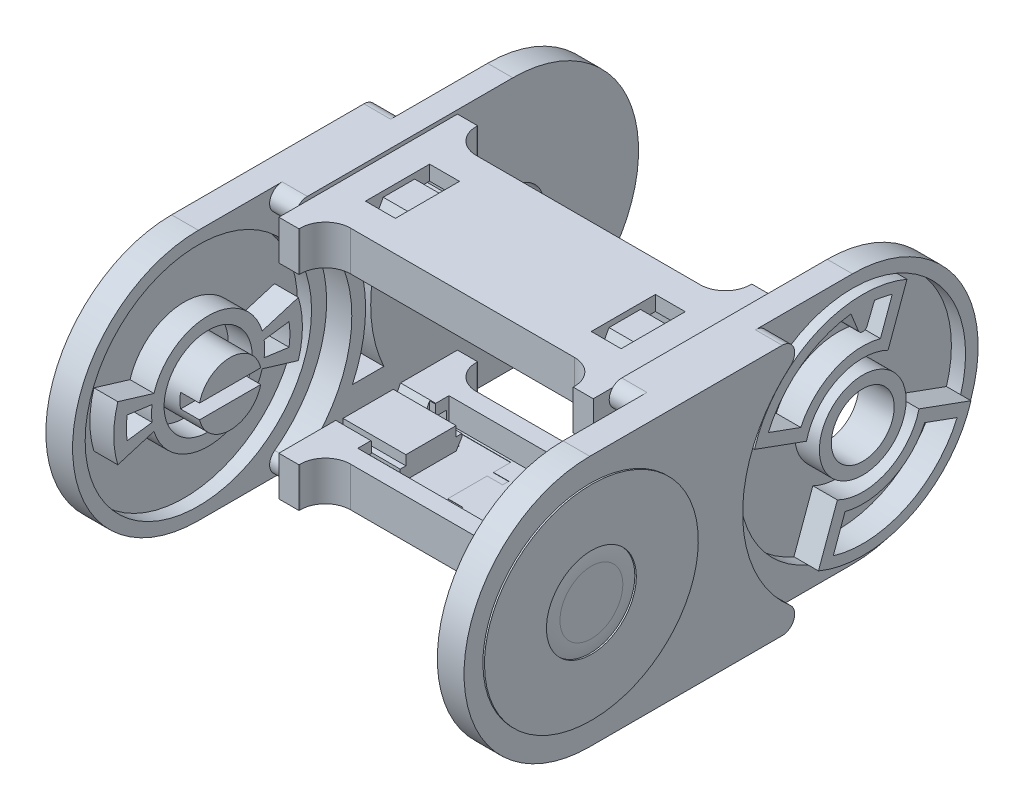
from build123d import *

# Parameters (mm, degrees)
SKETCH1_R            = 5
BOSS_EXTRUDE1_DEPTH  = 2
SKETCH2_RX           = 17
SKETCH2_RY           = 16.25
SKETCH2_R            = 7.15
BOSS_EXTRUDE2_DEPTH  = 0.25
BOSS_EXTRUDE3_START  = 2.25
SKETCH3_R            = 18
BOSS_EXTRUDE3_DEPTH  = 2.25
SKETCH5_R            = 7
BOSS_EXTRUDE4_DEPTH  = 3.8
SKETCH6_R            = 5
BOSS_EXTRUDE5_DEPTH  = 4
SKETCH7_R            = 18
CUT_EXTRUDE1_DEPTH   = 2.25
BOSS_EXTRUDE6_START  = 3.9
SKETCH8_R            = 6.9
SKETCH8_R_2          = 5
BOSS_EXTRUDE6_DEPTH  = 3.9
BOSS_EXTRUDE7_REACH  = 71.195
CUT_EXTRUDE2_DEPTH   = 6.3
BOSS_EXTRUDE8_DEPTH  = 10
BOSS_EXTRUDE9_DEPTH  = 4.3
SKETCH17_W           = 4.75
SKETCH17_H           = 10.2
BOSS_EXTRUDE10_DEPTH = 6.3
SKETCH18_W           = 13.78
SKETCH18_H           = 2.15
CUT_EXTRUDE3_DEPTH   = 15.8
CUT_EXTRUDE4_DEPTH   = 11.25
CUT_EXTRUDE5_START   = -3.95
SKETCH20_W           = 7
SKETCH20_H           = 1
CUT_EXTRUDE5_DEPTH   = 3.95
SKETCH21_W           = 38.8
SKETCH21_H           = 14.5
CUT_EXTRUDE6_DEPTH   = 3.9
SKETCH24_W           = 10
SKETCH24_H           = 2.3
CUT_EXTRUDE7_DEPTH   = 3


with BuildPart() as part:
    # Sketch1 → Boss-Extrude1 (new body)
    with BuildSketch(Plane(origin=(31.25, 0, 0), x_dir=(0, 0, -1), z_dir=(1, 0, 0))):
        with BuildLine():
            Line((0, 20), (30.582801811, 20))
            ThreePointArc((30.582801811, 20), (32.458698221, 18.693550761), (31.883831194, 16.481012658))
            ThreePointArc((31.883831194, 16.481012658), (24.3, 0), (31.883831194, -16.481012658))
            ThreePointArc((31.883831194, -16.481012658), (32.458698221, -18.693550761), (30.582801811, -20))
            Line((30.582801811, -20), (0, -20))
            ThreePointArc((0, -20), (-20, 0), (0, 20))
        make_face()
        Circle(SKETCH1_R, mode=Mode.SUBTRACT)
    extrude(amount=BOSS_EXTRUDE1_DEPTH)

    # Sketch2 → Boss-Extrude2 (add)
    with BuildSketch(Plane(origin=(33.25, 0, 0), x_dir=(0, 0, -1), z_dir=(1, 0, 0))):
        with Locations(Location((0, 0), (0, 0, 180))):
            Ellipse(SKETCH2_RX, SKETCH2_RY)
        Circle(SKETCH2_R, mode=Mode.SUBTRACT)
    extrude(amount=BOSS_EXTRUDE2_DEPTH)

    # Sketch3 → Boss-Extrude3 (add)
    with BuildSketch(Plane.ZY.offset(-31.25).offset(BOSS_EXTRUDE3_START)):
        with BuildLine():
            Line((-30.582801811, -20), (0, -20))
            ThreePointArc((0, -20), (20, 0), (0, 20))
            Line((0, 20), (-30.582801811, 20))
            ThreePointArc((-30.582801811, 20), (-32.458698221, 18.693550761), (-31.883831194, 16.481012658))
            ThreePointArc((-31.883831194, 16.481012658), (-24.3, 0), (-31.883831194, -16.481012658))
            ThreePointArc((-31.883831194, -16.481012658), (-32.458698221, -18.693550761), (-30.582801811, -20))
        make_face()
        Circle(SKETCH3_R, mode=Mode.SUBTRACT)
    extrude(amount=-BOSS_EXTRUDE3_DEPTH)

    # Sketch5 → Boss-Extrude4 (add)
    with BuildSketch(Plane.ZY.offset(-31.25)):
        with BuildLine():
            Line((-8.613239809, 2.61), (-14.355399681, 4.35))
            ThreePointArc((-14.355399681, 4.35), (-15, 0), (-14.355399681, -4.35))
            Line((-14.355399681, -4.35), (-8.613239809, -2.61))
            ThreePointArc((-8.613239809, -2.61), (0, -9), (8.613239809, -2.61))
            Line((8.613239809, -2.61), (14.355399681, -4.35))
            ThreePointArc((14.355399681, -4.35), (15, 0), (14.355399681, 4.35))
            Line((14.355399681, 4.35), (8.613239809, 2.61))
            ThreePointArc((8.613239809, 2.61), (0, 9), (-8.613239809, 2.61))
        make_face()
        with Locations(Location((0, 0, 0), (0, 0, 180))):
            Circle(SKETCH5_R, mode=Mode.SUBTRACT)
        with BuildLine():
            Line((-12.877930704, 1.777329677), (-8.915490487, 1.230459007))
            ThreePointArc((-8.915490487, 1.230459007), (-9, 0), (-8.915490487, -1.230459007))
            Line((-8.915490487, -1.230459007), (-12.877930704, -1.777329677))
            ThreePointArc((-12.877930704, -1.777329677), (-13, 0), (-12.877930704, 1.777329677))
        make_face(mode=Mode.SUBTRACT)
        with BuildLine():
            Line((12.877930704, -1.777329677), (8.915490487, -1.230459007))
            ThreePointArc((8.915490487, -1.230459007), (9, 0), (8.915490487, 1.230459007))
            Line((8.915490487, 1.230459007), (12.877930704, 1.777329677))
            ThreePointArc((12.877930704, 1.777329677), (13, 0), (12.877930704, -1.777329677))
        make_face(mode=Mode.SUBTRACT)
    extrude(amount=BOSS_EXTRUDE4_DEPTH)

    # Sketch6 → Boss-Extrude5 (add)
    with BuildSketch(Plane(origin=(29, 0, 0), x_dir=(0, 0, -1), z_dir=(1, 0, 0))):
        with BuildLine():
            Line((13.33266665, 20), (46, 20))
            ThreePointArc((46, 20), (66, 0), (46, -20))
            Line((46, -20), (13.33266665, -20))
            ThreePointArc((13.33266665, -20), (11.433418679, -18.626783171), (12.142249985, -16.392857143))
            ThreePointArc((12.142249985, -16.392857143), (20.4, 0), (12.142249985, 16.392857143))
            ThreePointArc((12.142249985, 16.392857143), (11.433418679, 18.626783171), (13.33266665, 20))
        make_face()
        with Locations((46, 0)):
            Circle(SKETCH6_R, mode=Mode.SUBTRACT)
    extrude(amount=-BOSS_EXTRUDE5_DEPTH)

    # Sketch7 → Cut-Extrude1 (cut)
    with BuildSketch(Plane(origin=(29, 0, 0), x_dir=(0, 0, -1), z_dir=(1, 0, 0))):
        with Locations((46, 0)):
            Circle(SKETCH7_R)
    extrude(amount=-CUT_EXTRUDE1_DEPTH, mode=Mode.SUBTRACT)

    # Sketch8 → Boss-Extrude6 (add)
    # profile 1 of 3: a face of its own
    with BuildSketch(Plane(origin=(26.75, 0, 0), x_dir=(0, 0, -1), z_dir=(1, 0, 0)).offset(BOSS_EXTRUDE6_START)):
        with Locations((46, 0)):
            Circle(SKETCH8_R)
        with Locations((46, 0)):
            Circle(SKETCH8_R_2, mode=Mode.SUBTRACT)
    # profile 2 of 3: a face of its own
    with BuildSketch(Plane(origin=(26.75, 0, 0), x_dir=(0, 0, -1), z_dir=(1, 0, 0)).offset(BOSS_EXTRUDE6_START)):
        with BuildLine():
            Line((53.040490335, 16.565974038), (50.031068965, 8.297656778))
            ThreePointArc((50.031068965, 8.297656778), (42.101346535, 8.360689335), (37.05250495, 2.245652986))
            Line((37.05250495, 2.245652986), (28.784187689, 5.255074356))
            ThreePointArc((28.784187689, 5.255074356), (38.392871289, 16.313540167), (53.040490335, 16.565974038))
        make_face()
        with BuildLine():
            Line((50.689873826, 15.662936618), (48.81254202, 10.505009871))
            ThreePointArc((48.81254202, 10.505009871), (41.404026404, 9.856097184), (36.144828401, 4.597957999))
            Line((36.144828401, 4.597957999), (30.986901654, 6.475289806))
            ThreePointArc((30.986901654, 6.475289806), (39.090191421, 14.818132318), (50.689873826, 15.662936618))
        make_face(mode=Mode.SUBTRACT)
    # profile 3 of 3: a face of its own
    with BuildSketch(Plane(origin=(26.75, 0, 0), x_dir=(0, 0, -1), z_dir=(1, 0, 0)).offset(BOSS_EXTRUDE6_START)):
        with BuildLine():
            Line((41.968931035, -8.297656778), (38.959509665, -16.565974038))
            ThreePointArc((38.959509665, -16.565974038), (53.607128711, -16.313540167), (63.215812311, -5.255074356))
            Line((63.215812311, -5.255074356), (54.94749505, -2.245652986))
            ThreePointArc((54.94749505, -2.245652986), (49.898653465, -8.360689335), (41.968931035, -8.297656778))
        make_face()
        with BuildLine():
            Line((41.310126174, -15.662936618), (43.18745798, -10.505009871))
            ThreePointArc((43.18745798, -10.505009871), (50.595973596, -9.856097184), (55.855171599, -4.597957999))
            Line((55.855171599, -4.597957999), (61.013098346, -6.475289806))
            ThreePointArc((61.013098346, -6.475289806), (52.909808579, -14.818132318), (41.310126174, -15.662936618))
        make_face(mode=Mode.SUBTRACT)
    extrude(amount=-BOSS_EXTRUDE6_DEPTH)

    # Sketch9 → Boss-Extrude7 (add, up to next)
    with BuildSketch(Plane(origin=(30.65, 0, 0), x_dir=(0, 0, -1), z_dir=(1, 0, 0)), mode=Mode.PRIVATE) as boss_extrude7_sk1:
        with BuildLine():
            Line((44.125, 16.242132711), (45.304497128, 13.319329812))
            ThreePointArc((45.304497128, 13.319329812), (46, 12.85), (46.695502872, 13.319329812))
            Line((46.695502872, 13.319329812), (47.875, 16.242132711))
            ThreePointArc((47.875, 16.242132711), (46, 16.35), (44.125, 16.242132711))
        make_face()
    boss_extrude7_tool1 = extrude(boss_extrude7_sk1.sketch, amount=-BOSS_EXTRUDE7_REACH, mode=Mode.PRIVATE) - part.part
    add(boss_extrude7_tool1.solids().sort_by_distance((30.65, 14.938571, -46))[0])

    # Sketch10 → Cut-Extrude2 (cut)
    with BuildSketch(Plane.ZY.offset(-25)):
        with BuildLine():
            Line((-25.5, 9.5), (-20.5, 9.5))
            ThreePointArc((-20.5, 9.5), (-22.594247055, 0), (-20.5, -9.5))
            Line((-20.5, -9.5), (-25.5, -9.5))
            ThreePointArc((-25.5, -9.5), (-23.405752945, 0), (-25.5, 9.5))
        make_face()
    extrude(amount=-CUT_EXTRUDE2_DEPTH, mode=Mode.SUBTRACT)

    # Sketch11 → Boss-Extrude8 (add)
    with BuildSketch(Plane.ZY.offset(-25)):
        Polygon((-27, 13.4), (-27, 14.94), (-27.9, 14.94), (-27.9, 15.44), (-27, 16.9), (-19, 16.9), (-18.1, 15.44), (-18.1, 14.94), (-19, 14.94), (-19, 13.4), align=None)
        Polygon((-19, -13.4), (-19, -14.94), (-18.1, -14.94), (-18.1, -15.44), (-19, -16.9), (-27, -16.9), (-27.9, -15.44), (-27.9, -14.94), (-27, -14.94), (-27, -13.4), align=None)
    extrude(amount=BOSS_EXTRUDE8_DEPTH)

    # Sketch15 → Boss-Extrude9 (add)
    with BuildSketch(Plane.ZY.offset(-15.8)):
        Polygon((-25.5, 18.75), (-20.5, 18.75), (-19.5, 16.9), (-26.5, 16.9), align=None)
    boss_extrude9 = extrude(amount=-BOSS_EXTRUDE9_DEPTH)

    # Mirror1: Boss-Extrude9 across plane
    add(boss_extrude9.mirror(Plane.ZX))


with BuildPart() as body_2:
    # Mirror2: mirrored copy
    add(part.part.mirror(Plane(origin=(0, 0, 0), x_dir=(0, 0, 1), z_dir=(1, 0, 0))))


with BuildPart() as body_3:
    # Sketch17 → Boss-Extrude10 (new body)
    with BuildSketch(Plane(origin=(0, 19.4, 0), x_dir=(1, 0, 0), z_dir=(0, 1, 0))):
        with BuildLine():
            Line((21.8, 9), (21.8, 8.8))
            Line((21.8, 8.8), (25, 8.8))
            Line((25, 8.8), (25, 37.2))
            Line((25, 37.2), (21.8, 37.2))
            Line((21.8, 37.2), (21.8, 37))
            ThreePointArc((21.8, 37), (20.628427125, 34.171572875), (17.8, 33))
            Line((17.8, 33), (-17.8, 33))
            ThreePointArc((-17.8, 33), (-20.628427125, 34.171572875), (-21.8, 37))
            Line((-21.8, 37), (-21.8, 37.2))
            Line((-21.8, 37.2), (-25, 37.2))
            Line((-25, 37.2), (-25, 8.8))
            Line((-25, 8.8), (-21.8, 8.8))
            Line((-21.8, 8.8), (-21.8, 9))
            ThreePointArc((-21.8, 9), (-20.628427125, 11.828427125), (-17.8, 13))
            Line((-17.8, 13), (17.8, 13))
            ThreePointArc((17.8, 13), (20.628427125, 11.828427125), (21.8, 9))
        make_face()
        with Locations((17.95, 23)):
            Rectangle(SKETCH17_W, SKETCH17_H, mode=Mode.SUBTRACT)
        with Locations((-17.95, 23)):
            Rectangle(SKETCH17_W, SKETCH17_H, mode=Mode.SUBTRACT)
    extrude(amount=-BOSS_EXTRUDE10_DEPTH)

    # Sketch18 → Cut-Extrude3 (cut)
    with BuildSketch(Plane(origin=(25, 0, 0), x_dir=(0, 0, -1), z_dir=(1, 0, 0))):
        with Locations((23, 15.975)):
            Rectangle(SKETCH18_W, SKETCH18_H)
    cut_extrude3 = extrude(amount=-CUT_EXTRUDE3_DEPTH, mode=Mode.SUBTRACT)

    # Sketch19 → Cut-Extrude4 (cut)
    with BuildSketch(Plane(origin=(25, 0, 0), x_dir=(0, 0, -1), z_dir=(1, 0, 0))):
        Polygon((18.8, 14.9), (17.85, 13.1), (28.15, 13.1), (27.2, 14.9), align=None)
    cut_extrude4 = extrude(amount=-CUT_EXTRUDE4_DEPTH, mode=Mode.SUBTRACT)

    # Sketch20 → Cut-Extrude5 (cut)
    with BuildSketch(Plane.XZ.offset(-13.1).offset(CUT_EXTRUDE5_START)):
        with Locations((10.25, -26.625)):
            Rectangle(SKETCH20_W, SKETCH20_H)
        with Locations((10.25, -19.375)):
            Rectangle(SKETCH20_W, SKETCH20_H)
    cut_extrude5 = extrude(amount=CUT_EXTRUDE5_DEPTH, mode=Mode.SUBTRACT)

    # Mirror5: Cut-Extrude3, Cut-Extrude4, Cut-Extrude5 across plane
    add(cut_extrude3.mirror(Plane(origin=(0, 0, 0), x_dir=(0, 0, 1), z_dir=(1, 0, 0))), mode=Mode.SUBTRACT)
    add(cut_extrude4.mirror(Plane(origin=(0, 0, 0), x_dir=(0, 0, 1), z_dir=(1, 0, 0))), mode=Mode.SUBTRACT)
    add(cut_extrude5.mirror(Plane(origin=(0, 0, 0), x_dir=(0, 0, 1), z_dir=(1, 0, 0))), mode=Mode.SUBTRACT)

    # Sketch21 → Cut-Extrude6 (cut)
    with BuildSketch(Plane.XZ.offset(-13.1)):
        with Locations((0, -23)):
            Rectangle(SKETCH21_W, SKETCH21_H)
    extrude(amount=-CUT_EXTRUDE6_DEPTH, mode=Mode.SUBTRACT)


with BuildPart() as body_4:
    # Mirror4: mirrored copy
    add(body_3.part.mirror(Plane.ZX))


with BuildPart() as body_5:
    # Sketch23 → Revolve1 (revolve)
    with BuildSketch(Plane(origin=(0, 0, 0), x_dir=(1, 0, 0), z_dir=(0, 1, 0))):
        with BuildLine():
            Line((-23.95, 0), (-33.5, 0))
            Line((-33.5, 0), (-33.5, 5))
            ThreePointArc((-33.5, 5), (-33.437299523, 6.107079491), (-33.25, 7.2))
            Line((-33.25, 7.2), (-33.25, 5))
            Line((-33.25, 5), (-23.95, 5))
            Line((-23.95, 5), (-23.95, 0))
        make_face()
    revolve(axis=Axis((-23.95, 0, 0), (-1, 0, 0)))

    # Sketch24 → Cut-Extrude7 (cut)
    with BuildSketch(Plane(origin=(-23.95, 0, 0), x_dir=(0, 0, -1), z_dir=(1, 0, 0))):
        Rectangle(SKETCH24_W, SKETCH24_H)
    extrude(amount=-CUT_EXTRUDE7_DEPTH, mode=Mode.SUBTRACT)


with BuildPart() as body_6:
    # Mirror6: mirrored copy
    add(body_5.part.mirror(Plane(origin=(0, 0, 0), x_dir=(0, 0, 1), z_dir=(1, 0, 0))))


solid = Compound([part.part, body_2.part, body_3.part, body_4.part, body_5.part, body_6.part])
